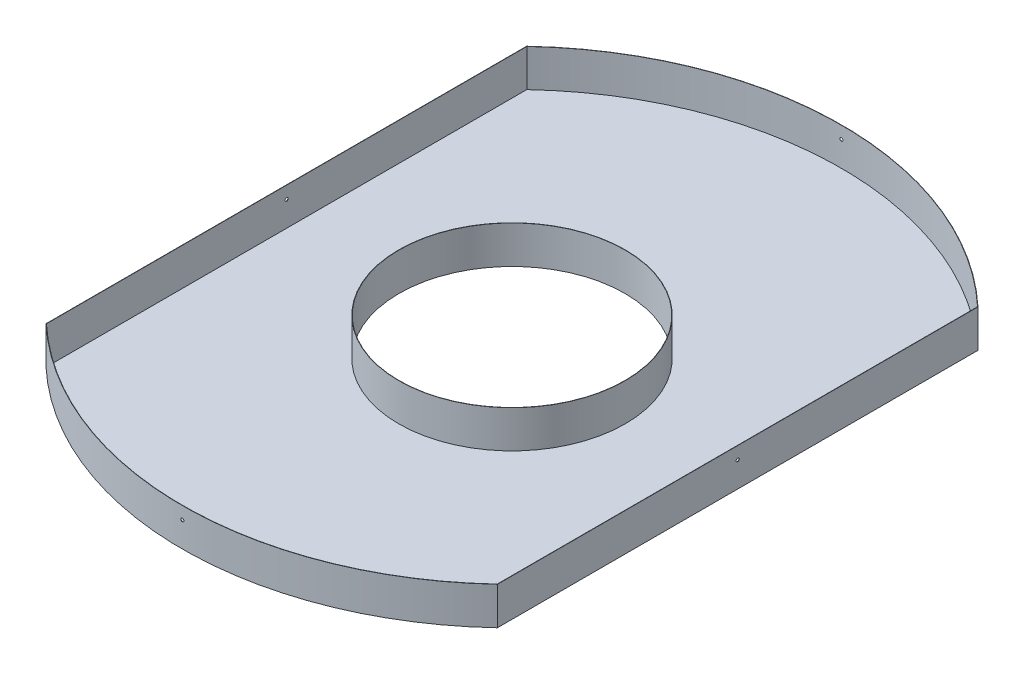
from build123d import *

# Parameters (mm, degrees)
SKETCH1_R                = 1750
BOSS_EXTRUDE1_DEPTH      = 500
SKETCH2_R                = 900
CUT_EXTRUDE2_DEPTH       = 300
CUT_EXTRUDE10_DEPTH      = 2525.8762345905193
CUT_EXTRUDE10_DEPTH_BACK = 2525.8762345905193
SKETCH10_W               = 4401.176040259436
SKETCH10_H               = 5623.086471134002
SKETCH10_W_2             = 2396.1198389626156
SKETCH10_H_2             = 4339.917258657096
SKETCH3_R                = 600.0000000000001
CUT_EXTRUDE3_DEPTH       = 300
SHELL1_T                 = -1.5
SKETCH11_W               = 3093.3575823896363
SKETCH11_H               = 4860.990486612289
CUT_EXTRUDE11_DEPTH      = 2142.9261356703128
SKETCH7_R                = 8.382000000000005
CUT_EXTRUDE6_DEPTH       = 900
CIRPATTERN1_COUNT        = 4
SKETCH13_R               = 901.5
SKETCH13_R_2             = 601.5
CUT_EXTRUDE14_DEPTH      = 10


with BuildPart() as part:
    # Sketch1 → Boss-Extrude1 (new body)
    with BuildSketch(Plane(origin=(0, 0, 0), x_dir=(1, 0, 0), z_dir=(0, 1, 0))):
        with Locations(Location((0, 0, 0), (0, 0, 270))):
            Circle(SKETCH1_R)
    extrude(amount=BOSS_EXTRUDE1_DEPTH)

    # Sketch2 → Cut-Extrude2 (cut)
    with BuildSketch(Plane(origin=(0, 500, 0), x_dir=(1, 0, 0), z_dir=(0, 1, 0))):
        with Locations(Location((0, 0, 0), (0, 0, 270))):
            Circle(SKETCH2_R)
    extrude(amount=-CUT_EXTRUDE2_DEPTH, mode=Mode.SUBTRACT)

    # Sketch10 → Cut-Extrude10 (cut, two sides: drawn at the far end of the back side and taken through both)
    with BuildSketch(Plane(origin=(0, 500, 0), x_dir=(1, 0, 0), z_dir=(0, 1, 0)).offset(-CUT_EXTRUDE10_DEPTH_BACK)):
        Rectangle(SKETCH10_W, SKETCH10_H)
        Rectangle(SKETCH10_W_2, SKETCH10_H_2, mode=Mode.SUBTRACT)
    extrude(amount=CUT_EXTRUDE10_DEPTH + CUT_EXTRUDE10_DEPTH_BACK, mode=Mode.SUBTRACT)

    # Sketch3 → Cut-Extrude3 (cut)
    with BuildSketch(Plane.XZ):
        with Locations(Location((0, 0, 0), (0, 0, 270))):
            Circle(SKETCH3_R)
    extrude(amount=-CUT_EXTRUDE3_DEPTH, mode=Mode.SUBTRACT)

    # Shell1
    shell1_openings = [part.faces().sort_by_distance(p)[0] for p in [
        (-1155.643660473, 500, 0),
    ]]
    offset(amount=SHELL1_T, openings=shell1_openings, kind=Kind.INTERSECTION)

    # Sketch11 → Cut-Extrude11 (cut, through all)
    with BuildSketch(Plane(origin=(0, 200, 0), x_dir=(1, 0, 0), z_dir=(0, 1, 0))):
        Rectangle(SKETCH11_W, SKETCH11_H)
    extrude(amount=CUT_EXTRUDE11_DEPTH, mode=Mode.SUBTRACT)

    # Sketch7 → Cut-Extrude6 (cut)
    with BuildSketch(Plane.XY.offset(2000)):
        with Locations((0, 133.89763942289122)):
            Circle(SKETCH7_R)
    cut_extrude6 = extrude(amount=-CUT_EXTRUDE6_DEPTH, mode=Mode.SUBTRACT)

    # CirPattern1: Cut-Extrude6 ×4 about axis
    cirpattern1_axis = Axis((0, 500, 0), (0, -1, 0))
    for i in range(1, CIRPATTERN1_COUNT):
        add(cut_extrude6.rotate(cirpattern1_axis, i * 360 / CIRPATTERN1_COUNT), mode=Mode.SUBTRACT)

    # Sketch13 → Cut-Extrude14 (cut)
    with BuildSketch(Plane(origin=(0, 200, 0), x_dir=(1, 0, 0), z_dir=(0, 1, 0))):
        Circle(SKETCH13_R)
        with Locations(Location((0, 0, 0), (0, 0, 270))):
            Circle(SKETCH13_R_2, mode=Mode.SUBTRACT)
    extrude(amount=-CUT_EXTRUDE14_DEPTH, mode=Mode.SUBTRACT)


solid = part.part
